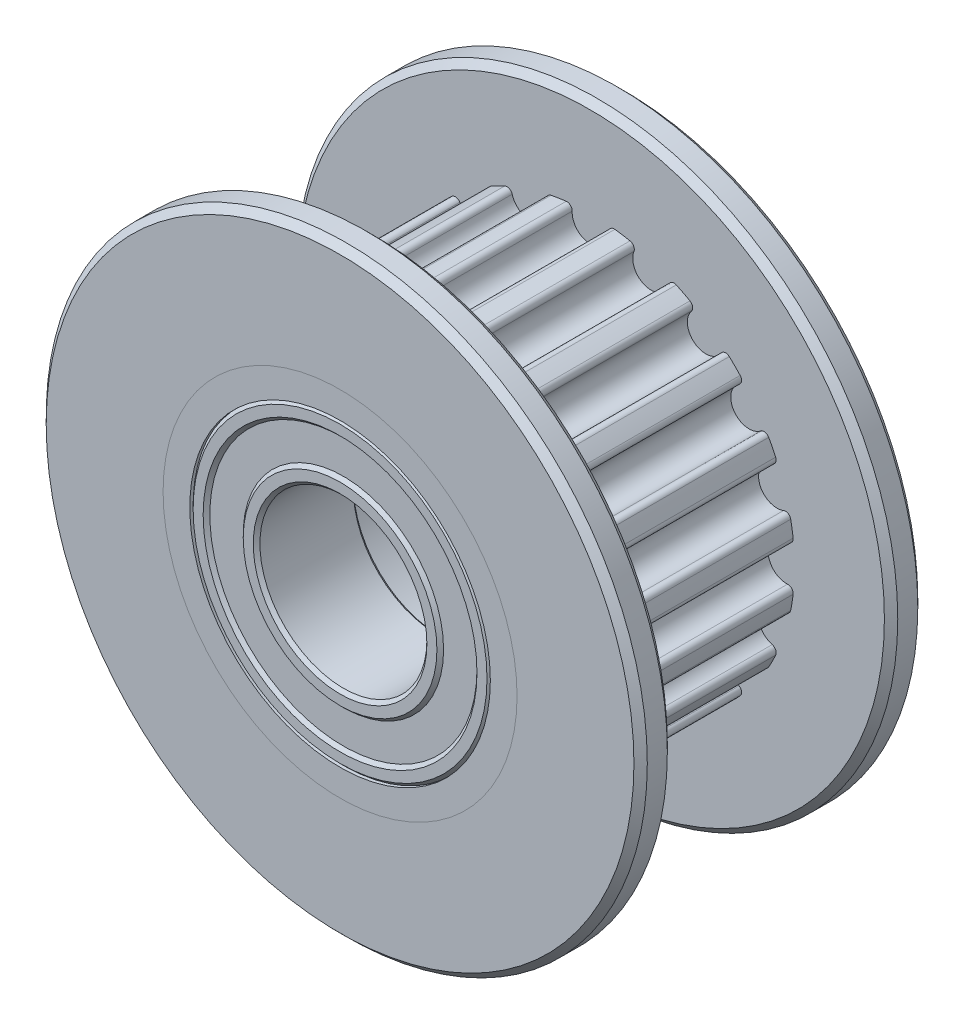
from build123d import *

# Parameters (mm, degrees)
SKICA1_R                  = 5.3
SKICA1_R_2                = 4
P_IDAT_VYSUNUT_M1_DEPTH   = 8.5
SKICA1_3_R                = 9
SKICA1_3_R_2              = 5.3
P_IDAT_VYSUNUT_M2_DEPTH   = 1
SKICA2_R                  = 5.3
P_IDAT_VYSUNUT_M5_DEPTH   = 6.5
SKICA4_R                  = 9
SKICA4_R_2                = 5.3
P_IDAT_VYSUNUT_M6_DEPTH   = 1
SKICA5_R                  = 4.5
ODEBRAT_VYSUNUT_M3_DEPTH  = 3
ODEBRAT_START             = -3
SKICA6_R                  = 4.5
ODEBRAT_VYSUNUT_M4_DEPTH  = 3
ZKOSEN_1_SIZE             = 0.2
ZKOSEN_2_SIZE             = 0.2
SKICA7_R                  = 4.5
SKICA7_R_2                = 4
P_IDAT_VYSUNUT_M7_DEPTH   = 3
SKICA7_R_3                = 3
SKICA7_R_4                = 2.5
P_IDAT_VYSUNUT_M7_2_DEPTH = 3
P_IDAT_START              = 0.1
SKICA7_3_R                = 4
SKICA7_3_R_2              = 3
P_IDAT_VYSUNUT_M8_DEPTH   = 2.8
ZKOSEN_3_SIZE             = 0.1
ZKOSEN_4_SIZE             = 0.1
SKICA8_R                  = 4.5
SKICA8_R_2                = 4
P_IDAT_VYSUNUT_M9_DEPTH   = 3
SKICA8_R_3                = 3
SKICA8_R_4                = 2.5
P_IDAT_VYSUNUT_M9_2_DEPTH = 3
SKICA8_3_R                = 4
SKICA8_3_R_2              = 3
P_IDAT_VYSUNUT_M10_DEPTH  = 2.8
ZKOSEN_5_SIZE             = 0.1
ZKOSEN_6_SIZE             = 0.1
ZKOSEN_7_SIZE             = 0.1
ZKOSEN_8_SIZE             = 0.1
ZKOSEN_10_SIZE            = 0.1
ZKOSEN_12_SIZE            = 0.1


with BuildPart() as part:
    # Skica1 → Přidat vysunutím1 (new body)
    with BuildSketch(Plane.XY):
        Circle(SKICA1_R)
        Circle(SKICA1_R_2, mode=Mode.SUBTRACT)
    extrude(amount=P_IDAT_VYSUNUT_M1_DEPTH)

    # Skica5 → Odebrat vysunutím3 (cut)
    with BuildSketch(Plane.XY.offset(8.5)):
        Circle(SKICA5_R)
    extrude(amount=-ODEBRAT_VYSUNUT_M3_DEPTH, mode=Mode.SUBTRACT)

    # Skica6 → Odebrat vysunutím4 (cut)
    with BuildSketch(Plane(origin=(0, 0, 0), x_dir=(-1, 0, 0), z_dir=(0, 0, -1)).offset(ODEBRAT_START)):
        Circle(SKICA6_R)
    extrude(amount=ODEBRAT_VYSUNUT_M4_DEPTH, mode=Mode.SUBTRACT)


with BuildPart() as body_2:
    # Skica1<3> → Přidat vysunutím2 (new body)
    with BuildSketch(Plane.XY):
        Circle(SKICA1_3_R)
        Circle(SKICA1_3_R_2, mode=Mode.SUBTRACT)
    extrude(amount=P_IDAT_VYSUNUT_M2_DEPTH)

    # Zkosení1
    zkosen_1_edges = [body_2.edges().sort_by_distance(p)[0] for p in [
        (-9, 0, 1),
        (-9, 0, 0),
    ]]
    chamfer(zkosen_1_edges, length=ZKOSEN_1_SIZE)


with BuildPart() as body_3:
    # Skica2 → Přidat vysunutím5 (new body)
    with BuildSketch(Plane.XY.offset(1)):
        with BuildLine():
            ThreePointArc((-0.549227949, 5.899131775), (0, 5.32), (0.549227949, 5.899131775))
            ThreePointArc((0.549227949, 5.899131775), (0.599687134, 6.024439536), (0.728068988, 6.06646648))
            ThreePointArc((0.728068988, 6.06646648), (0.955814581, 6.034775761), (1.182206482, 5.994538167))
            ThreePointArc((1.182206482, 5.994538167), (1.291317841, 5.914895994), (1.300585151, 5.780128485))
            ThreePointArc((1.300585151, 5.780128485), (1.64397041, 5.059620667), (2.34527879, 5.440686945))
            ThreePointArc((2.34527879, 5.440686945), (2.431990555, 5.544268962), (2.567075994, 5.544566786))
            ThreePointArc((2.567075994, 5.544566786), (2.773881953, 5.444049863), (2.976759346, 5.335822692))
            ThreePointArc((2.976759346, 5.335822692), (3.05591963, 5.22636122), (3.023087915, 5.095325947))
            ThreePointArc((3.023087915, 5.095325947), (3.127017542, 4.30397041), (3.911757403, 4.44966977))
            ThreePointArc((3.911757403, 4.44966977), (4.026233796, 4.521386713), (4.154799715, 4.479926264))
            ThreePointArc((4.154799715, 4.479926264), (4.320422433, 4.320422433), (4.479926264, 4.154799715))
            ThreePointArc((4.479926264, 4.154799715), (4.521386713, 4.026233796), (4.44966977, 3.911757403))
            ThreePointArc((4.44966977, 3.911757403), (4.30397041, 3.127017542), (5.095325947, 3.023087915))
            ThreePointArc((5.095325947, 3.023087915), (5.22636122, 3.05591963), (5.335822692, 2.976759346))
            ThreePointArc((5.335822692, 2.976759346), (5.444049863, 2.773881953), (5.544566786, 2.567075994))
            ThreePointArc((5.544566786, 2.567075994), (5.544268962, 2.431990555), (5.440686945, 2.34527879))
            ThreePointArc((5.440686945, 2.34527879), (5.059620667, 1.64397041), (5.780128485, 1.300585151))
            ThreePointArc((5.780128485, 1.300585151), (5.914895994, 1.291317841), (5.994538167, 1.182206482))
            ThreePointArc((5.994538167, 1.182206482), (6.034775761, 0.955814581), (6.06646648, 0.728068988))
            ThreePointArc((6.06646648, 0.728068988), (6.024439536, 0.599687134), (5.899131775, 0.549227949))
            ThreePointArc((5.899131775, 0.549227949), (5.32, 0), (5.899131775, -0.549227949))
            ThreePointArc((5.899131775, -0.549227949), (6.024439536, -0.599687134), (6.06646648, -0.728068988))
            ThreePointArc((6.06646648, -0.728068988), (6.034775761, -0.955814581), (5.994538167, -1.182206482))
            ThreePointArc((5.994538167, -1.182206482), (5.914895994, -1.291317841), (5.780128485, -1.300585151))
            ThreePointArc((5.780128485, -1.300585151), (5.059620667, -1.64397041), (5.440686945, -2.34527879))
            ThreePointArc((5.440686945, -2.34527879), (5.544268962, -2.431990555), (5.544566786, -2.567075994))
            ThreePointArc((5.544566786, -2.567075994), (5.444049863, -2.773881953), (5.335822692, -2.976759346))
            ThreePointArc((5.335822692, -2.976759346), (5.22636122, -3.05591963), (5.095325947, -3.023087915))
            ThreePointArc((5.095325947, -3.023087915), (4.30397041, -3.127017542), (4.44966977, -3.911757403))
            ThreePointArc((4.44966977, -3.911757403), (4.521386713, -4.026233796), (4.479926264, -4.154799715))
            ThreePointArc((4.479926264, -4.154799715), (4.320422433, -4.320422433), (4.154799715, -4.479926264))
            ThreePointArc((4.154799715, -4.479926264), (4.026233796, -4.521386713), (3.911757403, -4.44966977))
            ThreePointArc((3.911757403, -4.44966977), (3.127017542, -4.30397041), (3.023087915, -5.095325947))
            ThreePointArc((3.023087915, -5.095325947), (3.05591963, -5.22636122), (2.976759346, -5.335822692))
            ThreePointArc((2.976759346, -5.335822692), (2.773881953, -5.444049863), (2.567075994, -5.544566786))
            ThreePointArc((2.567075994, -5.544566786), (2.431990555, -5.544268962), (2.34527879, -5.440686945))
            ThreePointArc((2.34527879, -5.440686945), (1.64397041, -5.059620667), (1.300585151, -5.780128485))
            ThreePointArc((1.300585151, -5.780128485), (1.291317841, -5.914895994), (1.182206482, -5.994538167))
            ThreePointArc((1.182206482, -5.994538167), (0.955814581, -6.034775761), (0.728068988, -6.06646648))
            ThreePointArc((0.728068988, -6.06646648), (0.599687134, -6.024439536), (0.549227949, -5.899131775))
            ThreePointArc((0.549227949, -5.899131775), (0, -5.32), (-0.549227949, -5.899131775))
            ThreePointArc((-0.549227949, -5.899131775), (-0.599687134, -6.024439536), (-0.728068988, -6.06646648))
            ThreePointArc((-0.728068988, -6.06646648), (-0.955814581, -6.034775761), (-1.182206482, -5.994538167))
            ThreePointArc((-1.182206482, -5.994538167), (-1.291317841, -5.914895994), (-1.300585151, -5.780128485))
            ThreePointArc((-1.300585151, -5.780128485), (-1.64397041, -5.059620667), (-2.34527879, -5.440686945))
            ThreePointArc((-2.34527879, -5.440686945), (-2.431990555, -5.544268962), (-2.567075994, -5.544566786))
            ThreePointArc((-2.567075994, -5.544566786), (-2.773881953, -5.444049863), (-2.976759346, -5.335822692))
            ThreePointArc((-2.976759346, -5.335822692), (-3.05591963, -5.22636122), (-3.023087915, -5.095325947))
            ThreePointArc((-3.023087915, -5.095325947), (-3.127017542, -4.30397041), (-3.911757403, -4.44966977))
            ThreePointArc((-3.911757403, -4.44966977), (-4.026233796, -4.521386713), (-4.154799715, -4.479926264))
            ThreePointArc((-4.154799715, -4.479926264), (-4.320422433, -4.320422433), (-4.479926264, -4.154799715))
            ThreePointArc((-4.479926264, -4.154799715), (-4.521386713, -4.026233796), (-4.44966977, -3.911757403))
            ThreePointArc((-4.44966977, -3.911757403), (-4.30397041, -3.127017542), (-5.095325947, -3.023087915))
            ThreePointArc((-5.095325947, -3.023087915), (-5.22636122, -3.05591963), (-5.335822692, -2.976759346))
            ThreePointArc((-5.335822692, -2.976759346), (-5.444049863, -2.773881953), (-5.544566786, -2.567075994))
            ThreePointArc((-5.544566786, -2.567075994), (-5.544268962, -2.431990555), (-5.440686945, -2.34527879))
            ThreePointArc((-5.440686945, -2.34527879), (-5.059620667, -1.64397041), (-5.780128485, -1.300585151))
            ThreePointArc((-5.780128485, -1.300585151), (-5.914895994, -1.291317841), (-5.994538167, -1.182206482))
            ThreePointArc((-5.994538167, -1.182206482), (-6.034775761, -0.955814581), (-6.06646648, -0.728068988))
            ThreePointArc((-6.06646648, -0.728068988), (-6.024439536, -0.599687134), (-5.899131775, -0.549227949))
            ThreePointArc((-5.899131775, -0.549227949), (-5.32, 0), (-5.899131775, 0.549227949))
            ThreePointArc((-5.899131775, 0.549227949), (-6.024439536, 0.599687134), (-6.06646648, 0.728068988))
            ThreePointArc((-6.06646648, 0.728068988), (-6.034775761, 0.955814581), (-5.994538167, 1.182206482))
            ThreePointArc((-5.994538167, 1.182206482), (-5.914895994, 1.291317841), (-5.780128485, 1.300585151))
            ThreePointArc((-5.780128485, 1.300585151), (-5.059620667, 1.64397041), (-5.440686945, 2.34527879))
            ThreePointArc((-5.440686945, 2.34527879), (-5.544268962, 2.431990555), (-5.544566786, 2.567075994))
            ThreePointArc((-5.544566786, 2.567075994), (-5.444049863, 2.773881953), (-5.335822692, 2.976759346))
            ThreePointArc((-5.335822692, 2.976759346), (-5.22636122, 3.05591963), (-5.095325947, 3.023087915))
            ThreePointArc((-5.095325947, 3.023087915), (-4.30397041, 3.127017542), (-4.44966977, 3.911757403))
            ThreePointArc((-4.44966977, 3.911757403), (-4.521386713, 4.026233796), (-4.479926264, 4.154799715))
            ThreePointArc((-4.479926264, 4.154799715), (-4.320422433, 4.320422433), (-4.154799715, 4.479926264))
            ThreePointArc((-4.154799715, 4.479926264), (-4.026233796, 4.521386713), (-3.911757403, 4.44966977))
            ThreePointArc((-3.911757403, 4.44966977), (-3.127017542, 4.30397041), (-3.023087915, 5.095325947))
            ThreePointArc((-3.023087915, 5.095325947), (-3.05591963, 5.22636122), (-2.976759346, 5.335822692))
            ThreePointArc((-2.976759346, 5.335822692), (-2.773881953, 5.444049863), (-2.567075994, 5.544566786))
            ThreePointArc((-2.567075994, 5.544566786), (-2.431990555, 5.544268962), (-2.34527879, 5.440686945))
            ThreePointArc((-2.34527879, 5.440686945), (-1.64397041, 5.059620667), (-1.300585151, 5.780128485))
            ThreePointArc((-1.300585151, 5.780128485), (-1.291317841, 5.914895994), (-1.182206482, 5.994538167))
            ThreePointArc((-1.182206482, 5.994538167), (-0.955814581, 6.034775761), (-0.728068988, 6.06646648))
            ThreePointArc((-0.728068988, 6.06646648), (-0.599687134, 6.024439536), (-0.549227949, 5.899131775))
        make_face()
        Circle(SKICA2_R, mode=Mode.SUBTRACT)
    extrude(amount=P_IDAT_VYSUNUT_M5_DEPTH)


with BuildPart() as body_4:
    # Skica4 → Přidat vysunutím6 (new body)
    with BuildSketch(Plane.XY.offset(7.5)):
        Circle(SKICA4_R)
        Circle(SKICA4_R_2, mode=Mode.SUBTRACT)
    extrude(amount=P_IDAT_VYSUNUT_M6_DEPTH)

    # Zkosení2
    zkosen_2_edges = [body_4.edges().sort_by_distance(p)[0] for p in [
        (-9, 0, 7.5),
        (-9, 0, 8.5),
    ]]
    chamfer(zkosen_2_edges, length=ZKOSEN_2_SIZE)


with BuildPart() as body_5:
    # Skica7 → Přidat vysunutím7 (new body)
    with BuildSketch(Plane(origin=(0, 0, 3), x_dir=(-1, 0, 0), z_dir=(0, 0, -1))):
        Circle(SKICA7_R)
        Circle(SKICA7_R_2, mode=Mode.SUBTRACT)
    extrude(amount=P_IDAT_VYSUNUT_M7_DEPTH)

    # Zkosení3
    zkosen_3_edges = [body_5.edges().sort_by_distance(p)[0] for p in [
        (4, 0, 0),
        (4.5, 0, 0),
    ]]
    chamfer(zkosen_3_edges, length=ZKOSEN_3_SIZE)

    # Zkosení12
    zkosen_12_edges = [body_5.edges().sort_by_distance(p)[0] for p in [
        (4, 0, 3),
        (4.5, 0, 3),
    ]]
    chamfer(zkosen_12_edges, length=ZKOSEN_12_SIZE)


with BuildPart() as body_6:
    # Skica7 → P_idat vysunut_m7 2 (new body)
    with BuildSketch(Plane(origin=(0, 0, 3), x_dir=(-1, 0, 0), z_dir=(0, 0, -1))):
        Circle(SKICA7_R_3)
        Circle(SKICA7_R_4, mode=Mode.SUBTRACT)
    extrude(amount=P_IDAT_VYSUNUT_M7_2_DEPTH)

    # Zkosení4
    zkosen_4_edges = [body_6.edges().sort_by_distance(p)[0] for p in [
        (3, 0, 0),
        (2.5, 0, 0),
    ]]
    chamfer(zkosen_4_edges, length=ZKOSEN_4_SIZE)

    # Zkosení10
    zkosen_10_edges = [body_6.edges().sort_by_distance(p)[0] for p in [
        (3, 0, 3),
        (2.5, 0, 3),
    ]]
    chamfer(zkosen_10_edges, length=ZKOSEN_10_SIZE)


with BuildPart() as body_7:
    # Skica7<3> → Přidat vysunutím8 (new body)
    with BuildSketch(Plane(origin=(0, 0, 3), x_dir=(-1, 0, 0), z_dir=(0, 0, -1)).offset(P_IDAT_START)):
        Circle(SKICA7_3_R)
        Circle(SKICA7_3_R_2, mode=Mode.SUBTRACT)
    extrude(amount=P_IDAT_VYSUNUT_M8_DEPTH)


with BuildPart() as body_8:
    # Skica8 → Přidat vysunutím9 (new body)
    with BuildSketch(Plane.XY.offset(5.5)):
        Circle(SKICA8_R)
        Circle(SKICA8_R_2, mode=Mode.SUBTRACT)
    extrude(amount=P_IDAT_VYSUNUT_M9_DEPTH)

    # Zkosení5
    zkosen_5_edges = [body_8.edges().sort_by_distance(p)[0] for p in [
        (-4, 0, 8.5),
        (-4.5, 0, 8.5),
    ]]
    chamfer(zkosen_5_edges, length=ZKOSEN_5_SIZE)

    # Zkosení8
    zkosen_8_edges = [body_8.edges().sort_by_distance(p)[0] for p in [
        (-4.5, 0, 5.5),
        (-4, 0, 5.5),
    ]]
    chamfer(zkosen_8_edges, length=ZKOSEN_8_SIZE)


with BuildPart() as body_9:
    # Skica8 → P_idat vysunut_m9 2 (new body)
    with BuildSketch(Plane.XY.offset(5.5)):
        Circle(SKICA8_R_3)
        Circle(SKICA8_R_4, mode=Mode.SUBTRACT)
    extrude(amount=P_IDAT_VYSUNUT_M9_2_DEPTH)

    # Zkosení6
    zkosen_6_edges = [body_9.edges().sort_by_distance(p)[0] for p in [
        (-3, 0, 8.5),
        (-2.5, 0, 8.5),
    ]]
    chamfer(zkosen_6_edges, length=ZKOSEN_6_SIZE)

    # Zkosení7
    zkosen_7_edges = [body_9.edges().sort_by_distance(p)[0] for p in [
        (-3, 0, 5.5),
        (-2.5, 0, 5.5),
    ]]
    chamfer(zkosen_7_edges, length=ZKOSEN_7_SIZE)


with BuildPart() as body_10:
    # Skica8<3> → Přidat vysunutím10 (new body)
    with BuildSketch(Plane.XY.offset(5.5).offset(P_IDAT_START)):
        Circle(SKICA8_3_R)
        Circle(SKICA8_3_R_2, mode=Mode.SUBTRACT)
    extrude(amount=P_IDAT_VYSUNUT_M10_DEPTH)


solid = Compound([part.part, body_2.part, body_3.part, body_4.part, body_5.part, body_6.part, body_7.part, body_8.part, body_9.part, body_10.part])
